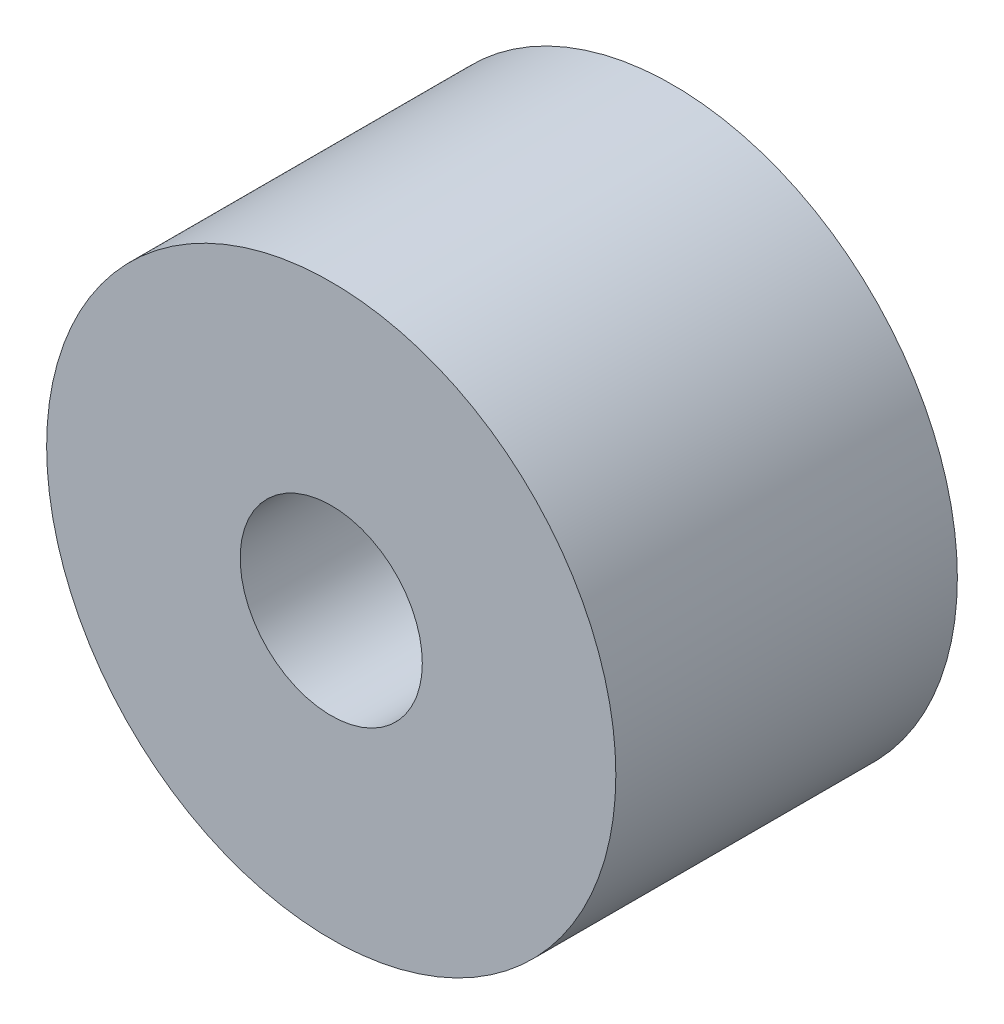
from build123d import *

# Parameters (mm, degrees)
SKETCH1_R     = 5
SKETCH1_R_2   = 1.6
GROMMET_DEPTH = 6


with BuildPart() as part:
    # Sketch1 → Grommet (new body)
    with BuildSketch(Plane.XY):
        Circle(SKETCH1_R)
        Circle(SKETCH1_R_2, mode=Mode.SUBTRACT)
    extrude(amount=GROMMET_DEPTH)


solid = part.part
